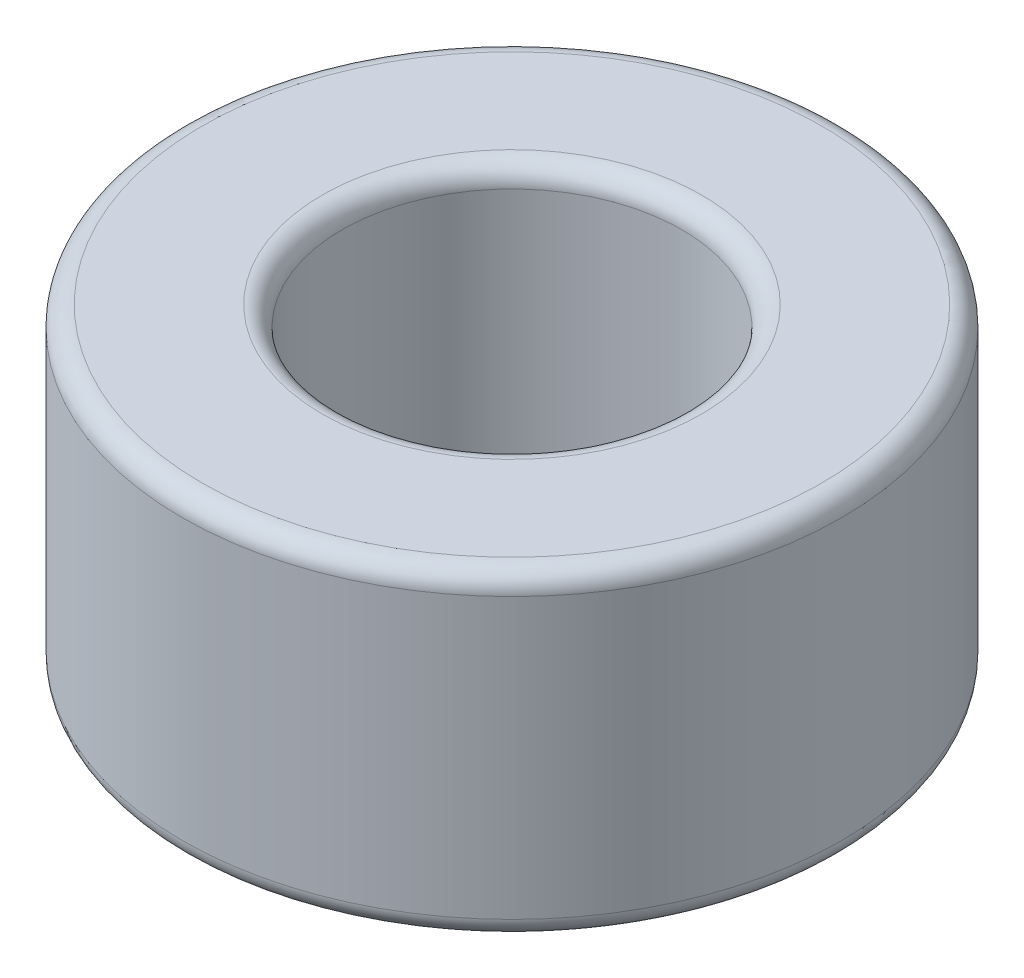
from build123d import *

# Parameters (mm, degrees)
SKETCH1_R           = 8.25
SKETCH1_R_2         = 4.25
BOSS_EXTRUDE1_DEPTH = 8
FILLET1_R           = 0.5


with BuildPart() as part:
    # Sketch1 → Boss-Extrude1 (new body)
    with BuildSketch(Plane(origin=(0, 0, 0), x_dir=(1, 0, 0), z_dir=(0, 1, 0))):
        with Locations(Location((0, 0, 0), (0, 0, 270))):
            Circle(SKETCH1_R)
        with Locations(Location((0, 0, 0), (0, 0, 270))):
            Circle(SKETCH1_R_2, mode=Mode.SUBTRACT)
    extrude(amount=BOSS_EXTRUDE1_DEPTH)

    # Fillet1
    fillet1_edges = [part.edges().sort_by_distance(p)[0] for p in [
        (0, 0, -8.25),
        (0, 8, -8.25),
        (0, 0, -4.25),
        (0, 8, -4.25),
    ]]
    fillet(fillet1_edges, radius=FILLET1_R)


solid = part.part
